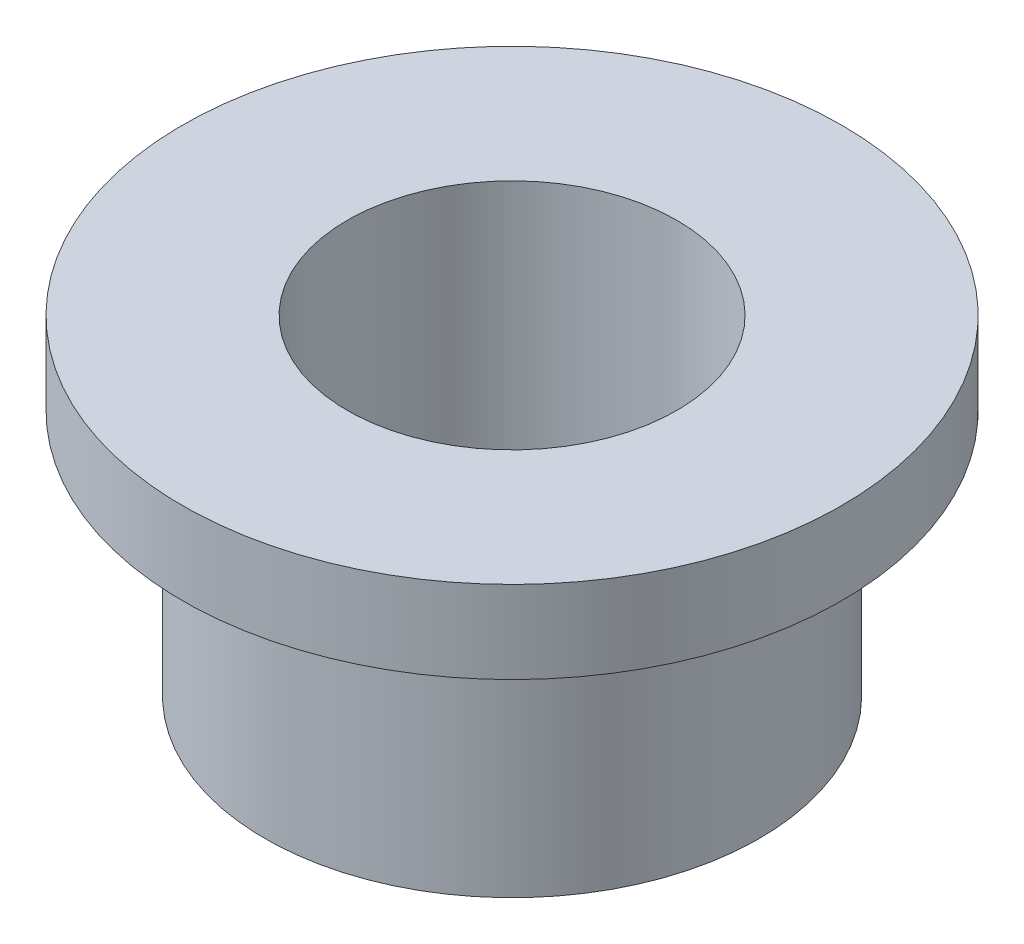
from build123d import *


with BuildPart() as part:
    # Sketch1 → Revolve-Thin1 (revolve)
    with BuildSketch(Plane.XY, mode=Mode.PRIVATE) as revolve_thin1_sk:
        Polygon((1, 0), (1, 2), (2, 2), (2, 1.5), (1.5, 1.5), (1.5, 0), align=None)
    revolve(revolve_thin1_sk.sketch.rotate(Axis((0, 0, 0), (0, 1, 0)), 90), axis=Axis((0, 0, 0), (0, 1, 0)))


solid = part.part
